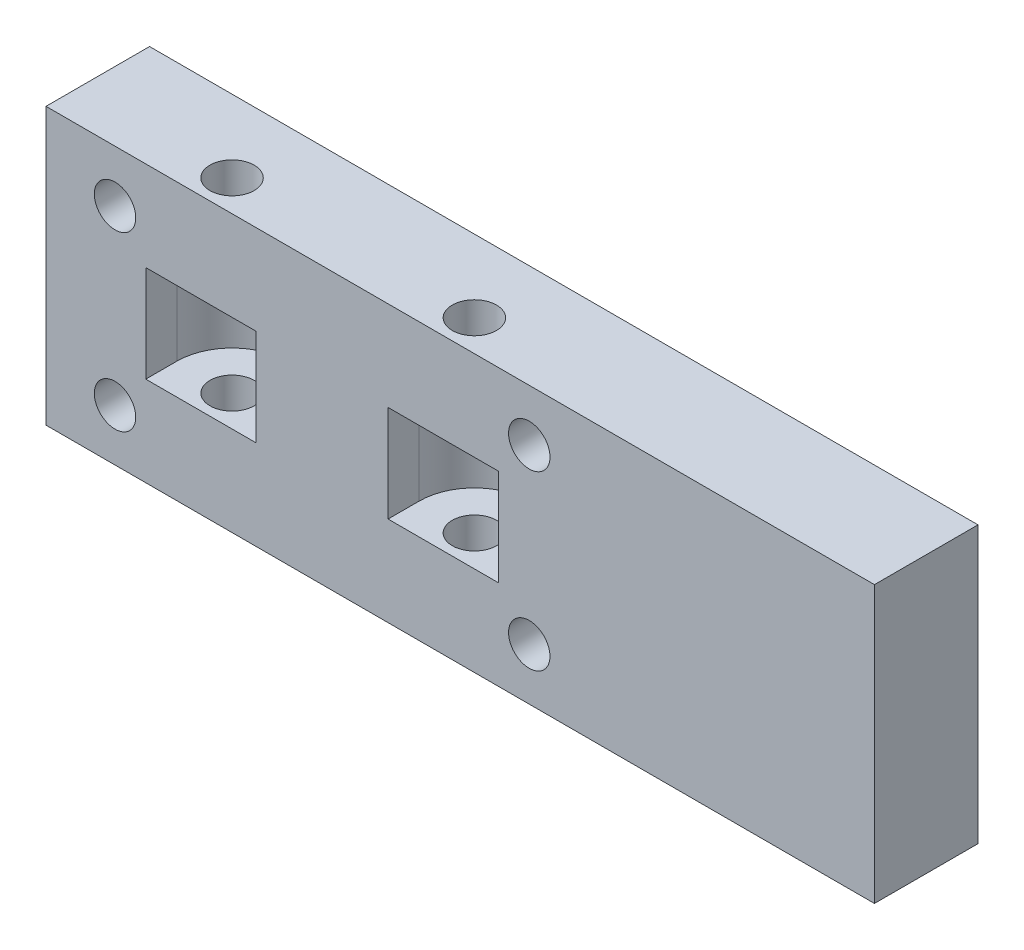
from build123d import *

# Parameters (mm, degrees)
SKETCH1_W               = 76.2
SKETCH1_H               = 25.4
BOSS_EXTRUDE1_DEPTH     = 9.525
CUT_EXTRUDE2_DEPTH      = 4.445
SKETCH2_R               = 1.905
CUT_EXTRUDE1_DEPTH      = 42.275
SKETCH5_R               = 2.032
CUT_EXTRUDE3_DEPTH      = 28.575
MIRROR2_COPY_1_SKETCH_R = 1.905
MIRROR2_COPY_1_DEPTH    = 42.275


with BuildPart() as part:
    # Sketch1 → Boss-Extrude1 (new body)
    with BuildSketch(Plane.XY):
        Rectangle(SKETCH1_W, SKETCH1_H)
    extrude(amount=BOSS_EXTRUDE1_DEPTH)

    # Sketch4 → Cut-Extrude2 (cut, symmetric)
    with BuildSketch(Plane(origin=(0, 0, 0), x_dir=(1, 0, 0), z_dir=(0, 1, 0))):
        with BuildLine():
            Line((-28.92425, -6.6675), (-28.92425, -9.525))
            Line((-28.92425, -9.525), (-18.76425, -9.525))
            Line((-18.76425, -9.525), (-18.76425, -6.6675))
            ThreePointArc((-18.76425, -6.6675), (-23.84425, -1.5875), (-28.92425, -6.6675))
        make_face()
    cut_extrude2 = extrude(amount=CUT_EXTRUDE2_DEPTH, both=True, mode=Mode.SUBTRACT)

    # Sketch2 → Cut-Extrude1 (cut, through all)
    with BuildSketch(Plane.XY.offset(9.525)):
        with Locations((-31.75, 7.9375)):
            Circle(SKETCH2_R)
    cut_extrude1 = extrude(amount=-CUT_EXTRUDE1_DEPTH, mode=Mode.SUBTRACT)

    # Sketch5 → Cut-Extrude3 (cut)
    with BuildSketch(Plane(origin=(0, 12.7, 0), x_dir=(1, 0, 0), z_dir=(0, 1, 0))):
        with Locations(Location((-23.84425, -6.6675, 0), (0, 0, 270))):
            Circle(SKETCH5_R)
    cut_extrude3 = extrude(amount=-CUT_EXTRUDE3_DEPTH, mode=Mode.SUBTRACT)

    # Mirror1: Cut-Extrude1 across plane
    add(cut_extrude1.mirror(Plane.ZX), mode=Mode.SUBTRACT)

    # Mirror2: Cut-Extrude2, Cut-Extrude1, Cut-Extrude3 across plane
    add(cut_extrude2.mirror(Plane.ZY.offset(12.7)), mode=Mode.SUBTRACT)
    add(cut_extrude1.mirror(Plane.ZY.offset(12.7)), mode=Mode.SUBTRACT)
    add(cut_extrude3.mirror(Plane.ZY.offset(12.7)), mode=Mode.SUBTRACT)

    # Mirror2 copy 1 sketch → Mirror2 copy 1 (cut, through all)
    with BuildSketch(Plane(origin=(-25.4, 0, 9.525), x_dir=(-1, 0, 0), z_dir=(0, 0, 1))):
        with Locations((-31.75, 7.9375)):
            Circle(MIRROR2_COPY_1_SKETCH_R)
    extrude(amount=-MIRROR2_COPY_1_DEPTH, mode=Mode.SUBTRACT)


solid = part.part
